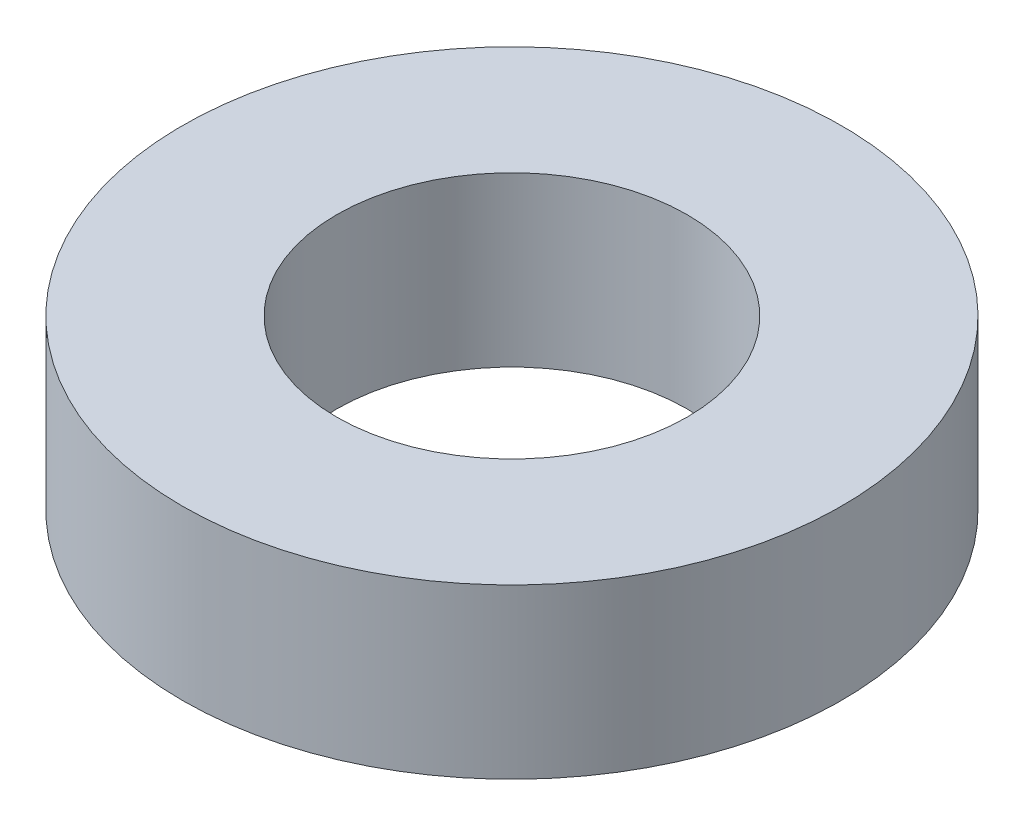
from build123d import *

# Parameters (mm, degrees)
SKETCH1_R           = 23.5
SKETCH1_R_2         = 12.5
BOSS_EXTRUDE1_DEPTH = 12


with BuildPart() as part:
    # Sketch1 → Boss-Extrude1 (new body)
    with BuildSketch(Plane(origin=(0, 0, 0), x_dir=(1, 0, 0), z_dir=(0, 1, 0))):
        with Locations(Location((0, 0, 0), (0, 0, 270))):
            Circle(SKETCH1_R)
        with Locations(Location((0, 0, 0), (0, 0, 270))):
            Circle(SKETCH1_R_2, mode=Mode.SUBTRACT)
    extrude(amount=BOSS_EXTRUDE1_DEPTH)


solid = part.part
